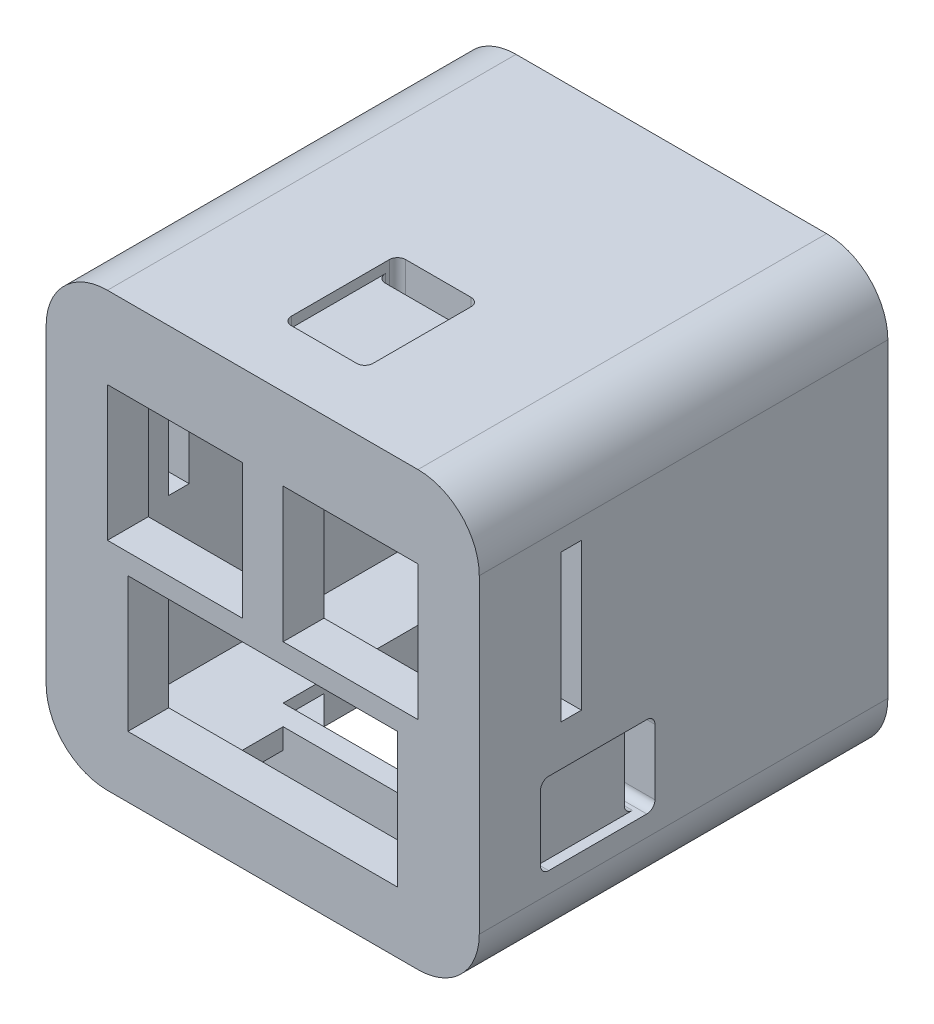
from build123d import *

# Parameters (mm, degrees)
SKETCH1_W           = 66
SKETCH1_H           = 33
SKETCH1_W_2         = 33
BOSS_EXTRUDE1_DEPTH = 100
SKETCH3_W           = 86
SKETCH3_H           = 86
CUT_EXTRUDE1_DEPTH  = 90
CUT_EXTRUDE2_DEPTH  = 2.5
CUT_EXTRUDE3_DEPTH  = 18.5
SKETCH6_W           = 120.471409441
SKETCH6_H           = 36
CUT_EXTRUDE4_DEPTH  = 5
CUT_EXTRUDE5_DEPTH  = 2.5
CUT_EXTRUDE6_DEPTH  = 10
SKETCH9_W           = 60
SKETCH9_H           = 10
CUT_EXTRUDE7_DEPTH  = 5
SKETCH10_W          = 40
SKETCH10_H          = 10
CUT_EXTRUDE8_DEPTH  = 5
SKETCH11_W          = 50
SKETCH11_H          = 50
CUT_EXTRUDE11_DEPTH = 3
CUT_EXTRUDE12_DEPTH = 10


with BuildPart() as part:
    # Sketch1 → Boss-Extrude1 (new body)
    with BuildSketch(Plane.XY):
        with BuildLine():
            Line((15, 0), (91, 0))
            ThreePointArc((91, 0), (101.606601718, 4.393398282), (106, 15))
            Line((106, 15), (106, 91))
            ThreePointArc((106, 91), (101.606601718, 101.606601718), (91, 106))
            Line((91, 106), (15, 106))
            ThreePointArc((15, 106), (4.393398282, 101.606601718), (0, 91))
            Line((0, 91), (0, 15))
            ThreePointArc((0, 15), (4.393398282, 4.393398282), (15, 0))
        make_face()
        with Locations((53, 31.5)):
            Rectangle(SKETCH1_W, SKETCH1_H, mode=Mode.SUBTRACT)
        with Locations((31.5, 69.5)):
            Rectangle(SKETCH1_W_2, SKETCH1_H, mode=Mode.SUBTRACT)
        with Locations((74.5, 69.5)):
            Rectangle(SKETCH1_W_2, SKETCH1_H, mode=Mode.SUBTRACT)
    extrude(amount=-BOSS_EXTRUDE1_DEPTH)

    # Sketch3 → Cut-Extrude1 (cut)
    with BuildSketch(Plane(origin=(0, 0, -100), x_dir=(-1, 0, 0), z_dir=(0, 0, -1))):
        with Locations((-53, 53)):
            Rectangle(SKETCH3_W, SKETCH3_H)
    extrude(amount=-CUT_EXTRUDE1_DEPTH, mode=Mode.SUBTRACT)

    # Sketch4 → Cut-Extrude2 (cut)
    with BuildSketch(Plane(origin=(0, 106, 0), x_dir=(1, 0, 0), z_dir=(0, 1, 0))):
        with BuildLine():
            Line((45, 43), (61, 43))
            ThreePointArc((61, 43), (62.414213562, 42.414213562), (63, 41))
            Line((63, 41), (63, 17))
            ThreePointArc((63, 17), (62.414213562, 15.585786438), (61, 15))
            Line((61, 15), (45, 15))
            ThreePointArc((45, 15), (43.585786438, 15.585786438), (43, 17))
            Line((43, 17), (43, 41))
            ThreePointArc((43, 41), (43.585786438, 42.414213562), (45, 43))
        make_face()
    extrude(amount=-CUT_EXTRUDE2_DEPTH, mode=Mode.SUBTRACT)

    # Sketch5 → Cut-Extrude3 (cut)
    with BuildSketch(Plane(origin=(0, 103.5, 0), x_dir=(1, 0, 0), z_dir=(0, 1, 0))):
        with BuildLine():
            Line((45, 38), (61, 38))
            ThreePointArc((61, 38), (62.414213562, 38.585786438), (63, 40))
            Line((63, 40), (63, 41))
            ThreePointArc((63, 41), (62.414213562, 42.414213562), (61, 43))
            Line((61, 43), (45, 43))
            ThreePointArc((45, 43), (43.585786438, 42.414213562), (43, 41))
            Line((43, 41), (43, 40))
            ThreePointArc((43, 40), (43.585786438, 38.585786438), (45, 38))
        make_face()
    extrude(amount=-CUT_EXTRUDE3_DEPTH, mode=Mode.SUBTRACT)

    # Sketch6 → Cut-Extrude4 (cut)
    with BuildSketch(Plane.XY.offset(-20)):
        with Locations((51.490660341, 68)):
            Rectangle(SKETCH6_W, SKETCH6_H)
    extrude(amount=-CUT_EXTRUDE4_DEPTH, mode=Mode.SUBTRACT)

    # Sketch7 → Cut-Extrude5 (cut)
    with BuildSketch(Plane(origin=(106, 0, 0), x_dir=(0, 0, -1), z_dir=(1, 0, 0))):
        with BuildLine():
            Line((17, 40), (41, 40))
            ThreePointArc((41, 40), (42.414213562, 39.414213562), (43, 38))
            Line((43, 38), (43, 22))
            ThreePointArc((43, 22), (42.414213562, 20.585786438), (41, 20))
            Line((41, 20), (17, 20))
            ThreePointArc((17, 20), (15.585786438, 20.585786438), (15, 22))
            Line((15, 22), (15, 38))
            ThreePointArc((15, 38), (15.585786438, 39.414213562), (17, 40))
        make_face()
    cut_extrude5 = extrude(amount=-CUT_EXTRUDE5_DEPTH, mode=Mode.SUBTRACT)

    # Sketch8 → Cut-Extrude6 (cut)
    with BuildSketch(Plane(origin=(103.5, 0, 0), x_dir=(0, 0, -1), z_dir=(1, 0, 0))):
        with BuildLine():
            Line((40, 40), (41, 40))
            ThreePointArc((41, 40), (42.414213562, 39.414213562), (43, 38))
            Line((43, 38), (43, 22))
            ThreePointArc((43, 22), (42.414213562, 20.585786438), (41, 20))
            Line((41, 20), (40, 20))
            ThreePointArc((40, 20), (38.585786438, 20.585786438), (38, 22))
            Line((38, 22), (38, 38))
            ThreePointArc((38, 38), (38.585786438, 39.414213562), (40, 40))
        make_face()
    cut_extrude6 = extrude(amount=-CUT_EXTRUDE6_DEPTH, mode=Mode.SUBTRACT)

    # Mirror1: Cut-Extrude5, Cut-Extrude6 across plane
    add(cut_extrude5.mirror(Plane(origin=(53, 0, 0), x_dir=(0, 0, 1), z_dir=(1, 0, 0))), mode=Mode.SUBTRACT)
    add(cut_extrude6.mirror(Plane(origin=(53, 0, 0), x_dir=(0, 0, 1), z_dir=(1, 0, 0))), mode=Mode.SUBTRACT)

    # Sketch9 → Cut-Extrude7 (cut)
    with BuildSketch(Plane.XZ):
        with Locations((53, -20)):
            Rectangle(SKETCH9_W, SKETCH9_H)
        with Locations((53, -90)):
            Rectangle(SKETCH9_W, SKETCH9_H)
    extrude(amount=-CUT_EXTRUDE7_DEPTH, mode=Mode.SUBTRACT)

    # Sketch10 → Cut-Extrude8 (cut)
    with BuildSketch(Plane.XZ.offset(-5)):
        with Locations((53, -20)):
            Rectangle(SKETCH10_W, SKETCH10_H)
        with Locations((53, -90)):
            Rectangle(SKETCH10_W, SKETCH10_H)
    extrude(amount=-CUT_EXTRUDE8_DEPTH, mode=Mode.SUBTRACT)

    # Sketch11 → Cut-Extrude11 (cut)
    with BuildSketch(Plane(origin=(0, 10, 0), x_dir=(1, 0, 0), z_dir=(0, 1, 0))):
        with Locations((53, 55)):
            Rectangle(SKETCH11_W, SKETCH11_H)
    extrude(amount=-CUT_EXTRUDE11_DEPTH, mode=Mode.SUBTRACT)

    # Sketch12 → Cut-Extrude12 (cut)
    with BuildSketch(Plane(origin=(0, 7, 0), x_dir=(1, 0, 0), z_dir=(0, 1, 0))):
        Polygon((38, 80), (68, 80), (78, 70.00000089), (78, 40.00000089), (68, 30), (38, 30), (28, 39.99999911), (28, 69.99999911), align=None)
    extrude(amount=-CUT_EXTRUDE12_DEPTH, mode=Mode.SUBTRACT)


solid = part.part
